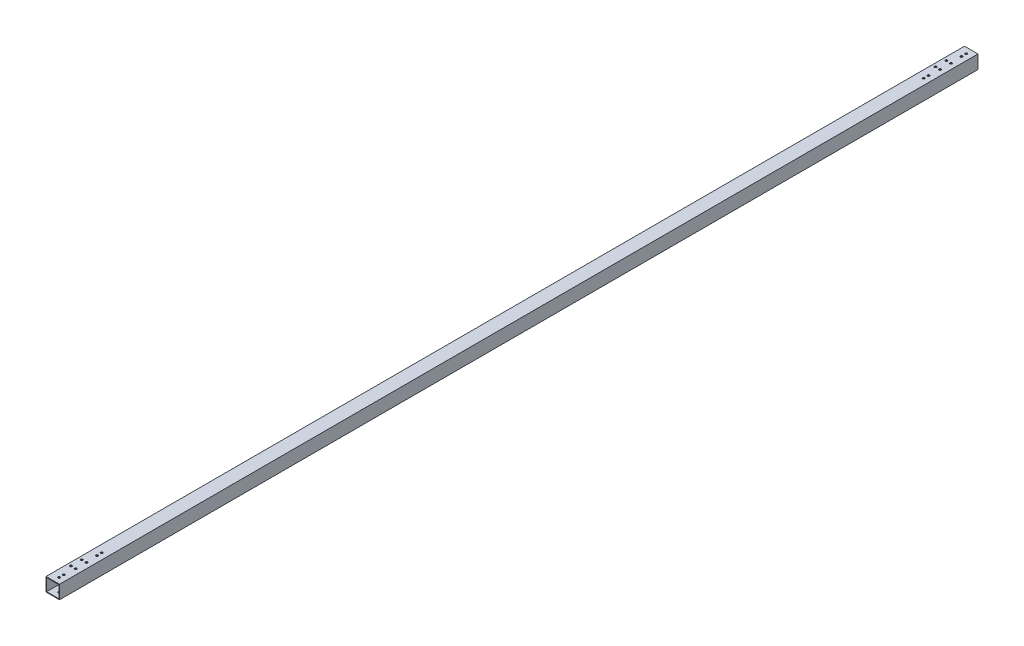
from build123d import *

# Parameters (mm, degrees)
SKETCH_1_W          = 20
SKETCH_1_H          = 20
SKETCH_1_W_2        = 18
SKETCH_1_H_2        = 18
EXTRUDE_1_DEPTH     = 1360
SKETCH_2_R          = 1.6
CUT_EXTRUDE_1_DEPTH = 1361.294085851
SKETCH_3_R          = 1.6
CUT_EXTRUDE_2_DEPTH = 1361.294085851


with BuildPart() as part:
    # 草图1 → 凸台-拉伸1 (new body)
    with BuildSketch(Plane.XY):
        with Locations((10, 10)):
            Rectangle(SKETCH_1_W, SKETCH_1_H)
        with Locations((10, 10)):
            Rectangle(SKETCH_1_W_2, SKETCH_1_H_2, mode=Mode.SUBTRACT)
    extrude(amount=EXTRUDE_1_DEPTH)

    # 草图2 → 切除-拉伸1 (cut, through all)
    with BuildSketch(Plane(origin=(0, 20, 0), x_dir=(1, 0, 0), z_dir=(0, 1, 0))):
        with Locations(Location((11, -15.5, 0), (0, 0, 270))):
            Circle(SKETCH_2_R)
        with Locations(Location((11, -8.5, 0), (0, 0, 270))):
            Circle(SKETCH_2_R)
        with Locations(Location((11, -71.5, 0), (0, 0, 270))):
            Circle(SKETCH_2_R)
        with Locations(Location((11, -64.5, 0), (0, 0, 270))):
            Circle(SKETCH_2_R)
        with Locations(Location((11, -1295.5, 0), (0, 0, 270))):
            Circle(SKETCH_2_R)
        with Locations(Location((11, -1288.5, 0), (0, 0, 270))):
            Circle(SKETCH_2_R)
        with Locations(Location((11, -1351.5, 0), (0, 0, 270))):
            Circle(SKETCH_2_R)
        with Locations(Location((11, -1344.5, 0), (0, 0, 270))):
            Circle(SKETCH_2_R)
    extrude(amount=-CUT_EXTRUDE_1_DEPTH, mode=Mode.SUBTRACT)

    # 草图3 → 切除-拉伸2 (cut, through all)
    with BuildSketch(Plane.XZ):
        with Locations(Location((12, 1312, 0), (0, 0, 270))):
            Circle(SKETCH_3_R)
        with Locations(Location((12, 1328, 0), (0, 0, 270))):
            Circle(SKETCH_3_R)
        with Locations(Location((12, 32, 0), (0, 0, 270))):
            Circle(SKETCH_3_R)
        with Locations(Location((12, 48, 0), (0, 0, 270))):
            Circle(SKETCH_3_R)
        with Locations(Location((5, 1312, 0), (0, 0, 270))):
            Circle(SKETCH_3_R)
        with Locations(Location((5, 1328, 0), (0, 0, 270))):
            Circle(SKETCH_3_R)
        with Locations(Location((5, 32, 0), (0, 0, 270))):
            Circle(SKETCH_3_R)
        with Locations(Location((5, 48, 0), (0, 0, 270))):
            Circle(SKETCH_3_R)
    extrude(amount=-CUT_EXTRUDE_2_DEPTH, mode=Mode.SUBTRACT)


solid = part.part
